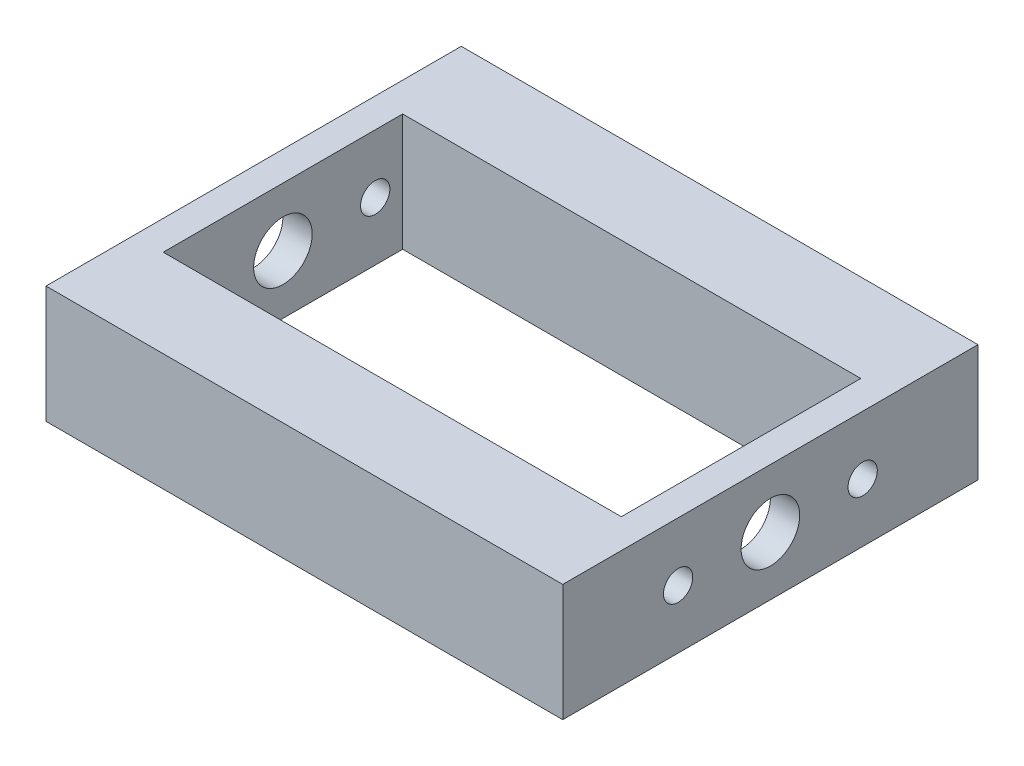
from build123d import *

# Parameters (mm, degrees)
CROQUIS1_W              = 150.1
CROQUIS1_H              = 90
CROQUIS1_W_2            = 99.3
CROQUIS1_H_2            = 51.9
SALIENTE_EXTRUIR1_DEPTH = 25.4
CROQUIS2_R              = 6.35
SALIENTE_EXTRUIR2_DEPTH = 51.85
SALIENTE_EXTRUIR3_START = -174.15
CROQUIS2_2_R            = 6.35
SALIENTE_EXTRUIR3_DEPTH = 24.05
CROQUIS4_R              = 3.175
CORTAR_EXTRUIR2_DEPTH   = 182.654569169
CORTAR_EXTRUIR3_START   = 51.85
CROQUIS2_3_R            = 6.35
CORTAR_EXTRUIR3_DEPTH   = 234.504569169
CROQUIS6_W              = 19.05
CROQUIS6_H              = 90
CORTAR_EXTRUIR4_DEPTH   = 92.118946987


with BuildPart() as part:
    # Croquis1 → Saliente-Extruir1 (new body)
    with BuildSketch(Plane(origin=(0, 0, 0), x_dir=(1, 0, 0), z_dir=(0, 1, 0))):
        Rectangle(CROQUIS1_W, CROQUIS1_H)
        Rectangle(CROQUIS1_W_2, CROQUIS1_H_2, mode=Mode.SUBTRACT)
    extrude(amount=SALIENTE_EXTRUIR1_DEPTH)

    # Croquis2 → Saliente-Extruir2 (add)
    with BuildSketch(Plane(origin=(75.05, 0, 0), x_dir=(0, 0, -1), z_dir=(1, 0, 0))):
        with Locations(Location((0, 12.7, 0), (0, 0, 180))):
            Circle(CROQUIS2_R)
    extrude(amount=SALIENTE_EXTRUIR2_DEPTH)

    # Croquis2<2> → Saliente-Extruir3 (add)
    with BuildSketch(Plane(origin=(75.05, 0, 0), x_dir=(0, 0, -1), z_dir=(1, 0, 0)).offset(SALIENTE_EXTRUIR3_START)):
        with Locations(Location((0, 12.7, 0), (0, 0, 180))):
            Circle(CROQUIS2_2_R)
    extrude(amount=SALIENTE_EXTRUIR3_DEPTH)

    # Croquis4 → Cortar-Extruir2 (cut, through all)
    with BuildSketch(Plane(origin=(75.05, 0, 0), x_dir=(0, 0, -1), z_dir=(1, 0, 0))):
        with Locations((-20, 12.7)):
            Circle(CROQUIS4_R)
        with Locations((20, 12.7)):
            Circle(CROQUIS4_R)
    extrude(amount=-CORTAR_EXTRUIR2_DEPTH, mode=Mode.SUBTRACT)

    # Croquis2<3> → Cortar-Extruir3 (cut, through all)
    with BuildSketch(Plane(origin=(75.05, 0, 0), x_dir=(0, 0, -1), z_dir=(1, 0, 0)).offset(CORTAR_EXTRUIR3_START)):
        with Locations(Location((0, 12.7, 0), (0, 0, 180))):
            Circle(CROQUIS2_3_R)
    extrude(amount=-CORTAR_EXTRUIR3_DEPTH, mode=Mode.SUBTRACT)

    # Croquis6 → Cortar-Extruir4 (cut, through all)
    with BuildSketch(Plane(origin=(0, 25.4, 0), x_dir=(1, 0, 0), z_dir=(0, 1, 0))):
        with Locations((-65.525, 0)):
            Rectangle(CROQUIS6_W, CROQUIS6_H)
        with Locations((65.525, 0)):
            Rectangle(CROQUIS6_W, CROQUIS6_H)
    extrude(amount=-CORTAR_EXTRUIR4_DEPTH, mode=Mode.SUBTRACT)


solid = part.part
